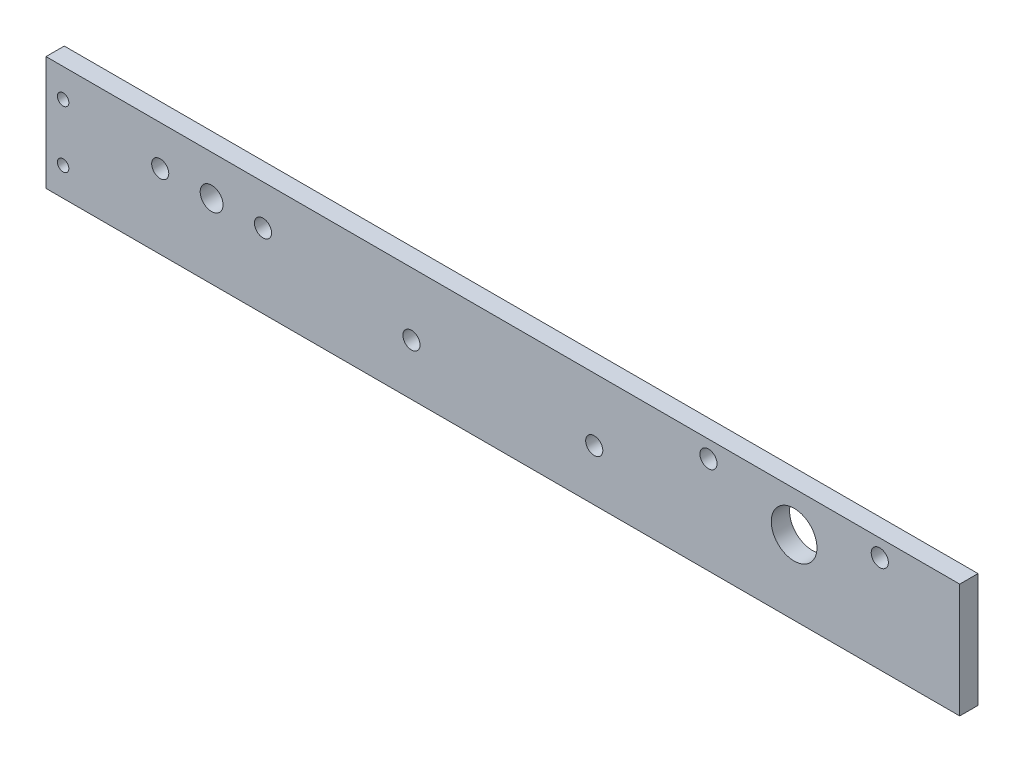
from build123d import *

# Parameters (mm, degrees)
SKETCH2_W               = 160
SKETCH2_H               = 20
BOSS_EXTRUDE1_DEPTH     = 3.2
CUT_EXTRUDE1_DEPTH      = 162.276904732
CUT_EXTRUDE1_DEPTH_BACK = 162.276904732
SKETCH5_R               = 4
SKETCH5_R_2             = 2
SKETCH6_R               = 1.5
CUT_EXTRUDE2_DEPTH      = 10
CUT_EXTRUDE3_DEPTH      = 162.276904732
CUT_EXTRUDE3_DEPTH_BACK = 162.276904732
SKETCH7_R               = 1
SKETCH8_R               = 1.5
CUT_EXTRUDE4_DEPTH      = 10
SKETCH9_R               = 1.5
CUT_EXTRUDE5_DEPTH      = 10


with BuildPart() as part:
    # Sketch2 → Boss-Extrude1 (new body)
    with BuildSketch(Plane(origin=(0, -10, 10), x_dir=(1, 0, 0), z_dir=(0, 0, -1))):
        with Locations((80, 0)):
            Rectangle(SKETCH2_W, SKETCH2_H)
    extrude(amount=BOSS_EXTRUDE1_DEPTH)

    # Sketch5 → Cut-Extrude1 (cut, two sides: drawn at the far end of the back side and taken through both)
    with BuildSketch(Plane.XY.offset(10).offset(-CUT_EXTRUDE1_DEPTH_BACK)):
        with Locations((131, -7)):
            Circle(SKETCH5_R)
        with Locations((29, -7)):
            Circle(SKETCH5_R_2)
    extrude(amount=CUT_EXTRUDE1_DEPTH + CUT_EXTRUDE1_DEPTH_BACK, mode=Mode.SUBTRACT)

    # Sketch6 → Cut-Extrude2 (cut)
    with BuildSketch(Plane.XY.offset(10)):
        with Locations((96, -11)):
            Circle(SKETCH6_R)
        with Locations((64, -11)):
            Circle(SKETCH6_R)
    extrude(amount=-CUT_EXTRUDE2_DEPTH, mode=Mode.SUBTRACT)

    # Sketch7 → Cut-Extrude3 (cut, two sides: drawn at the far end of the back side and taken through both)
    with BuildSketch(Plane.XY.offset(10).offset(-CUT_EXTRUDE3_DEPTH_BACK)):
        with Locations((3, -15)):
            Circle(SKETCH7_R)
        with Locations((3, -5)):
            Circle(SKETCH7_R)
    extrude(amount=CUT_EXTRUDE3_DEPTH + CUT_EXTRUDE3_DEPTH_BACK, mode=Mode.SUBTRACT)

    # Sketch8 → Cut-Extrude4 (cut)
    with BuildSketch(Plane.XY.offset(10)):
        with Locations((146, -3)):
            Circle(SKETCH8_R)
        with Locations((116, -3)):
            Circle(SKETCH8_R)
    extrude(amount=-CUT_EXTRUDE4_DEPTH, mode=Mode.SUBTRACT)

    # Sketch9 → Cut-Extrude5 (cut)
    with BuildSketch(Plane(origin=(0, 0, 6.8), x_dir=(-1, 0, 0), z_dir=(0, 0, -1))):
        with Locations((-20, -7)):
            Circle(SKETCH9_R)
        with Locations((-38, -7)):
            Circle(SKETCH9_R)
    extrude(amount=-CUT_EXTRUDE5_DEPTH, mode=Mode.SUBTRACT)


solid = part.part
